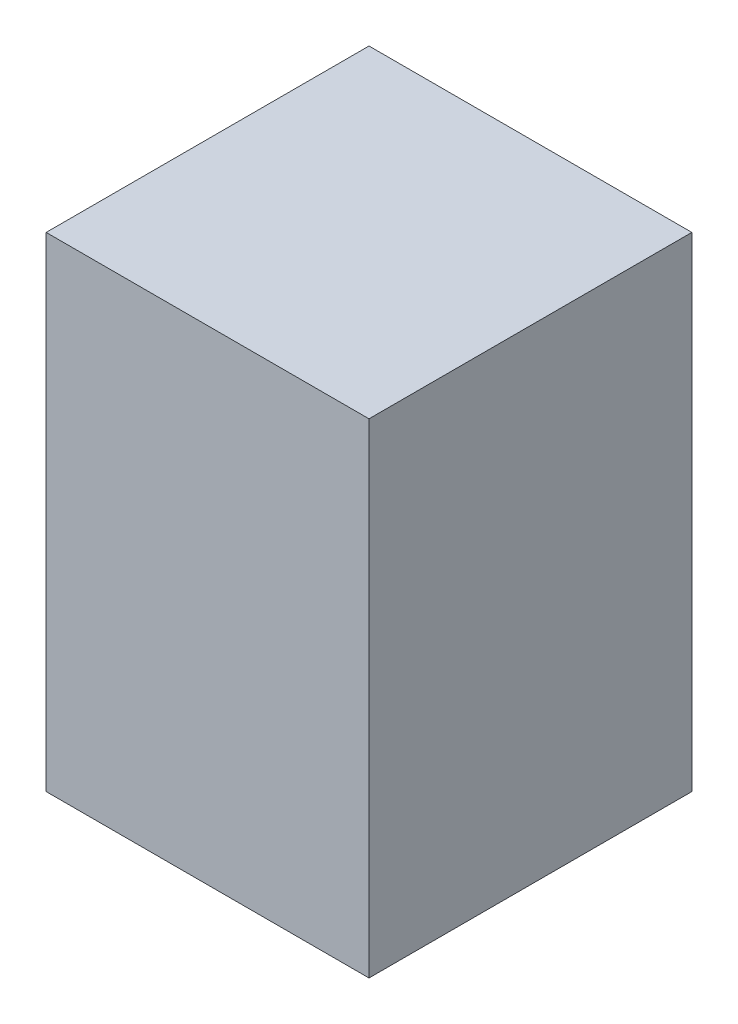
from build123d import *

# Parameters (mm, degrees)
PRESS_AYAK_1_1_START = -40
SKETCH1_W            = 80
SKETCH1_H            = 120
PRESS_AYAK_1_1_DEPTH = 80


with BuildPart() as part:
    # Sketch1 → PRESS_ayak_1_1 (new body)
    with BuildSketch(Plane.XY.offset(PRESS_AYAK_1_1_START)):
        with Locations((100, 60)):
            Rectangle(SKETCH1_W, SKETCH1_H)
    extrude(amount=-PRESS_AYAK_1_1_DEPTH)


solid = part.part
